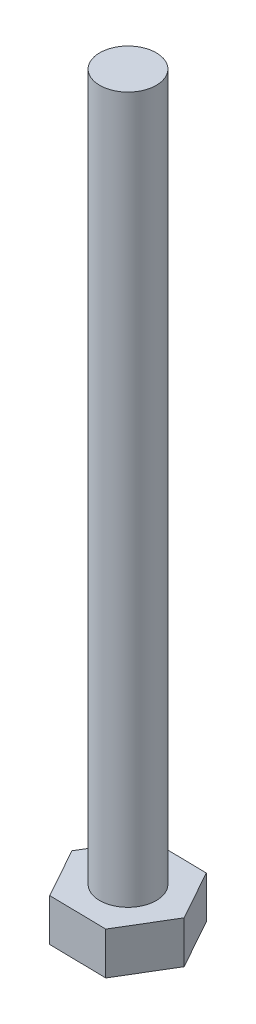
from build123d import *

# Parameters (mm, degrees)
BOSS_EXTRUDE1_DEPTH = 3
SKETCH2_R           = 2
BOSS_EXTRUDE2_DEPTH = 50


with BuildPart() as part:
    # Sketch1 → Boss-Extrude1 (new body)
    with BuildSketch(Plane(origin=(0, 0, 0), x_dir=(1, 0, 0), z_dir=(0, 1, 0))):
        Polygon((1.95908548, -3.534871627), (4.040831368, -0.07081802), (2.081745888, 3.464053607), (-1.95908548, 3.534871627), (-4.040831368, 0.07081802), (-2.081745888, -3.464053607), align=None)
    extrude(amount=BOSS_EXTRUDE1_DEPTH)

    # Sketch2 → Boss-Extrude2 (add)
    with BuildSketch(Plane(origin=(0, 3, 0), x_dir=(1, 0, 0), z_dir=(0, 1, 0))):
        with Locations(Location((0, 0, 0), (0, 0, 270))):
            Circle(SKETCH2_R)
    extrude(amount=BOSS_EXTRUDE2_DEPTH)


solid = part.part
